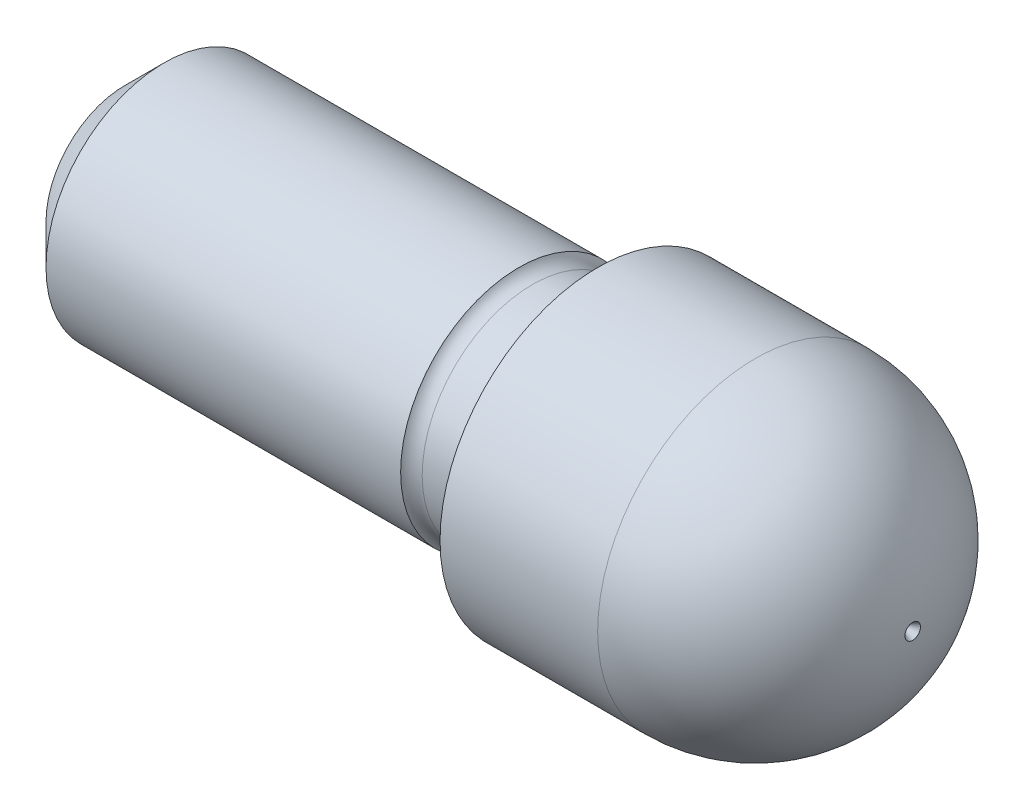
from build123d import *


with BuildPart() as part:
    # Sketch1 → Revolve1 (revolve)
    with BuildSketch(Plane(origin=(0, 0, 0), x_dir=(-1, 0, 0), z_dir=(0, 0, -1)), mode=Mode.PRIVATE) as revolve1_sk:
        with BuildLine():
            Line((-3.997568228, 0.098596016), (-3.826794919, 0))
            Line((-3.826794919, 0), (5.826794919, 0))
            Line((5.826794919, 0), (6, 0.1))
            Line((6, 0.1), (6, 1))
            Line((6, 1), (5.5, 1.5))
            Line((5.5, 1.5), (1, 1.5))
            ThreePointArc((1, 1.5), (0.926794919, 1.426794919), (0.826794919, 1.4))
            Line((0.826794919, 1.4), (0.2, 1.4))
            ThreePointArc((0.2, 1.4), (0.058578644, 1.458578644), (0, 1.6))
            Line((0, 1.6), (0, 2))
            Line((0, 2), (-2, 2))
            ThreePointArc((-2, 2), (-3.37891406, 1.448653173), (-3.997568228, 0.098596016))
        make_face()
    revolve(revolve1_sk.sketch.rotate(Axis((4.002354589, 0, 0), (-1, 0, 0)), 270), axis=Axis((4.002354589, 0, 0), (-1, 0, 0)))


solid = part.part
